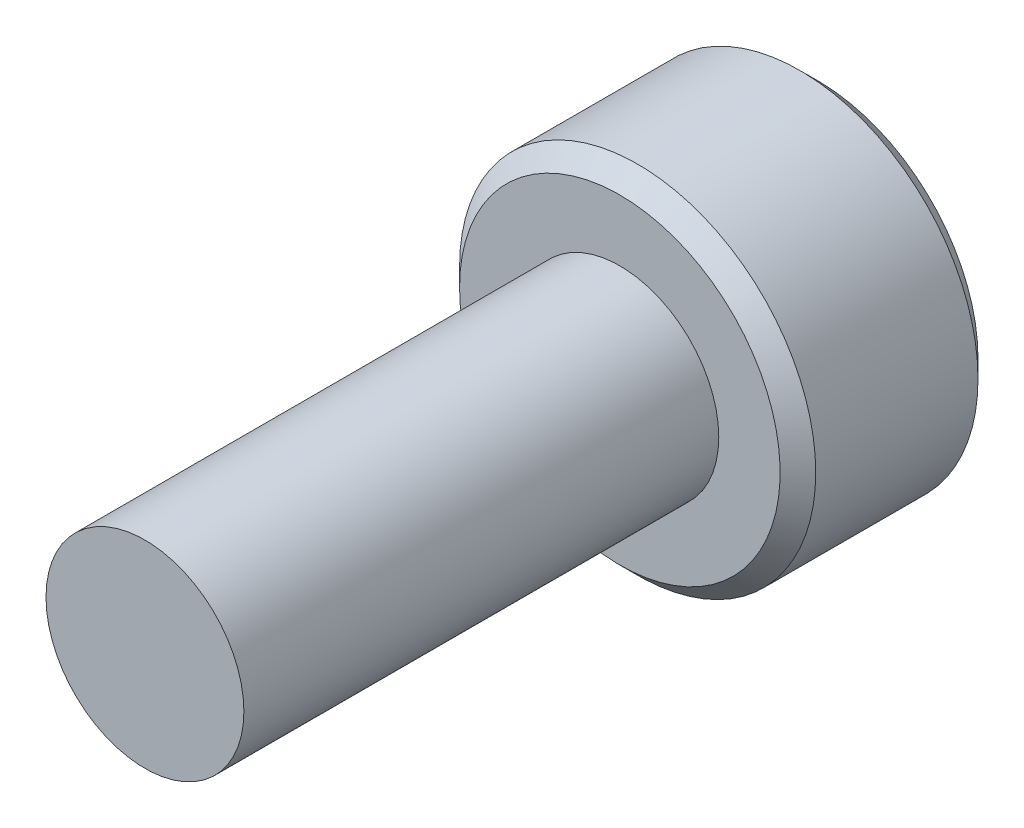
from build123d import *

# Parameters (mm, degrees)
SKETCH1_R          = 1.25
EXTRUDE1_DEPTH     = 6
SKETCH6_R          = 2.25
EXTRUDE2_DEPTH     = 2.5
CUT_EXTRUDE1_DEPTH = 1.5
CHAMFER1_SIZE      = 0.225


with BuildPart() as part:
    # Sketch1 → Extrude1 (new body)
    with BuildSketch(Plane.XY):
        Circle(SKETCH1_R)
    extrude(amount=-EXTRUDE1_DEPTH)

    # Sketch6 → Extrude2 (add)
    with BuildSketch(Plane(origin=(0, 0, -6), x_dir=(-1, 0, 0), z_dir=(0, 0, -1))):
        Circle(SKETCH6_R)
    extrude(amount=EXTRUDE2_DEPTH)

    # Sketch7 → Cut-Extrude1 (cut)
    with BuildSketch(Plane(origin=(0, 0, -8.5), x_dir=(-1, 0, 0), z_dir=(0, 0, -1))):
        Polygon((0, 1.154700538), (-1, 0.577350269), (-1, -0.577350269), (0, -1.154700538), (1, -0.577350269), (1, 0.577350269), align=None)
    extrude(amount=-CUT_EXTRUDE1_DEPTH, mode=Mode.SUBTRACT)

    # Cut-Extrude2 cone 1 section (through the dimple's axis) → Cut-Extrude2 (revolve, cut)
    with BuildSketch(Plane(origin=(0, 0, -8.5), x_dir=(0, 1, 0), z_dir=(1, 0, 0))):
        Polygon((0, 0), (1.154700538, 0), (0, 1.154700538), align=None)
    revolve(axis=Axis((0, 0, -8.5), (0, 0, 1)), mode=Mode.SUBTRACT)

    # Chamfer1
    chamfer1_edges = [part.edges().sort_by_distance(p)[0] for p in [
        (2.25, 0, -8.5),
        (2.25, 0, -6),
    ]]
    chamfer(chamfer1_edges, length=CHAMFER1_SIZE)


solid = part.part
